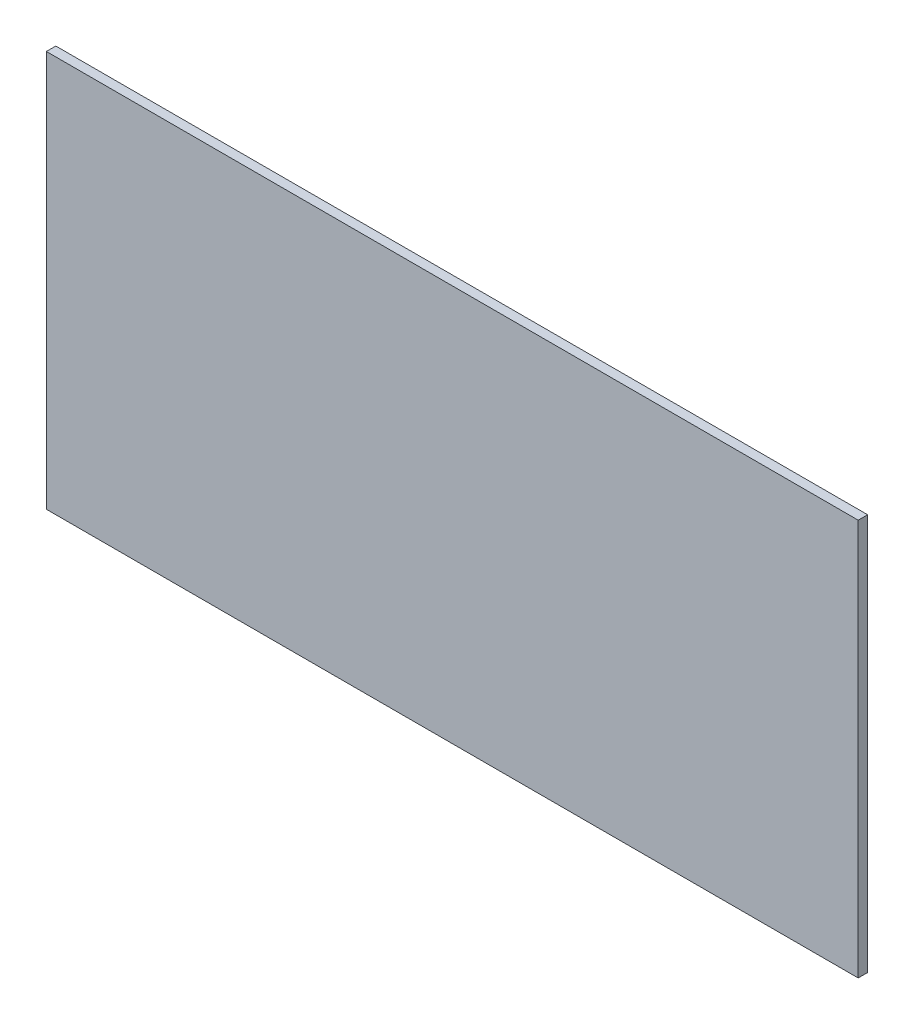
from build123d import *

# Parameters (mm, degrees)
CROQUIS1_W              = 409.525
CROQUIS1_H              = 200
SALIENTE_EXTRUIR5_DEPTH = 4.7625


with BuildPart() as part:
    # Croquis1 → Saliente-Extruir5 (new body)
    with BuildSketch(Plane.XY):
        with Locations((204.7625, 100)):
            Rectangle(CROQUIS1_W, CROQUIS1_H)
    extrude(amount=SALIENTE_EXTRUIR5_DEPTH)


solid = part.part
